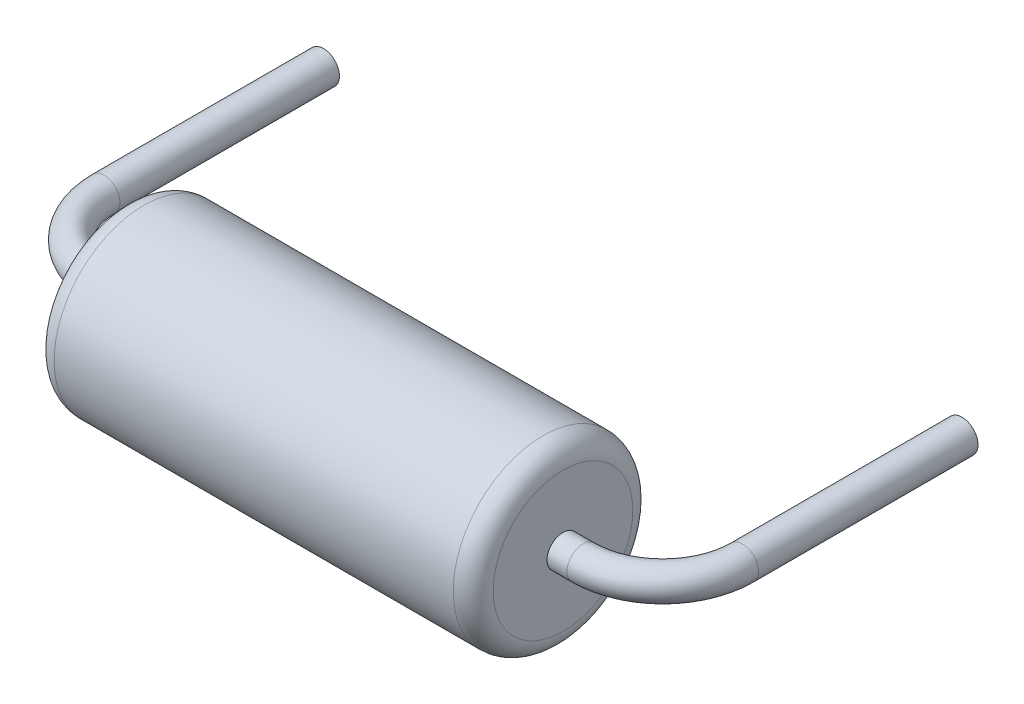
from build123d import *

# Parameters (mm, degrees)
SKETCH_3_R      = 2.25
EXTRUDE_1_DEPTH = 11
SKETCH_4_R      = 0.4
FILLET_1_R      = 0.5


with BuildPart() as part:
    # Эскиз3 → Вытянуть1 (new body)
    with BuildSketch(Plane(origin=(2.5, 0, 0), x_dir=(0, 0, -1), z_dir=(1, 0, 0))):
        with Locations((-2.25, 0)):
            Circle(SKETCH_3_R)
    extrude(amount=EXTRUDE_1_DEPTH)

    # По траектории1: sweep along a path in Эскиз5
    with BuildLine(Plane(origin=(0, 0, 0), x_dir=(1, 0, 0), z_dir=(0, 1, 0))) as sweep_1_path:
        Line((0, 5.25), (0, -0.25))
        ThreePointArc((0, -0.25), (0.585786438, -1.664213562), (2, -2.25))
        Line((2, -2.25), (2.965757317, -2.25))
        Line((2.965757317, -2.25), (14, -2.25))
        ThreePointArc((14, -2.25), (15.414213562, -1.664213562), (16, -0.25))
        Line((16, -0.25), (16, 5.25))
    # Эскиз4 → По траектории1 (sweep)
    with BuildSketch(Plane.XY.offset(-5.25)):
        Circle(SKETCH_4_R)
    sweep(path=sweep_1_path.line)

    # Скругление1
    fillet_1_edges = [part.edges().sort_by_distance(p)[0] for p in [
        (2.5, 0, 4.5),
        (13.5, 0, 4.5),
    ]]
    fillet(fillet_1_edges, radius=FILLET_1_R)


solid = part.part
